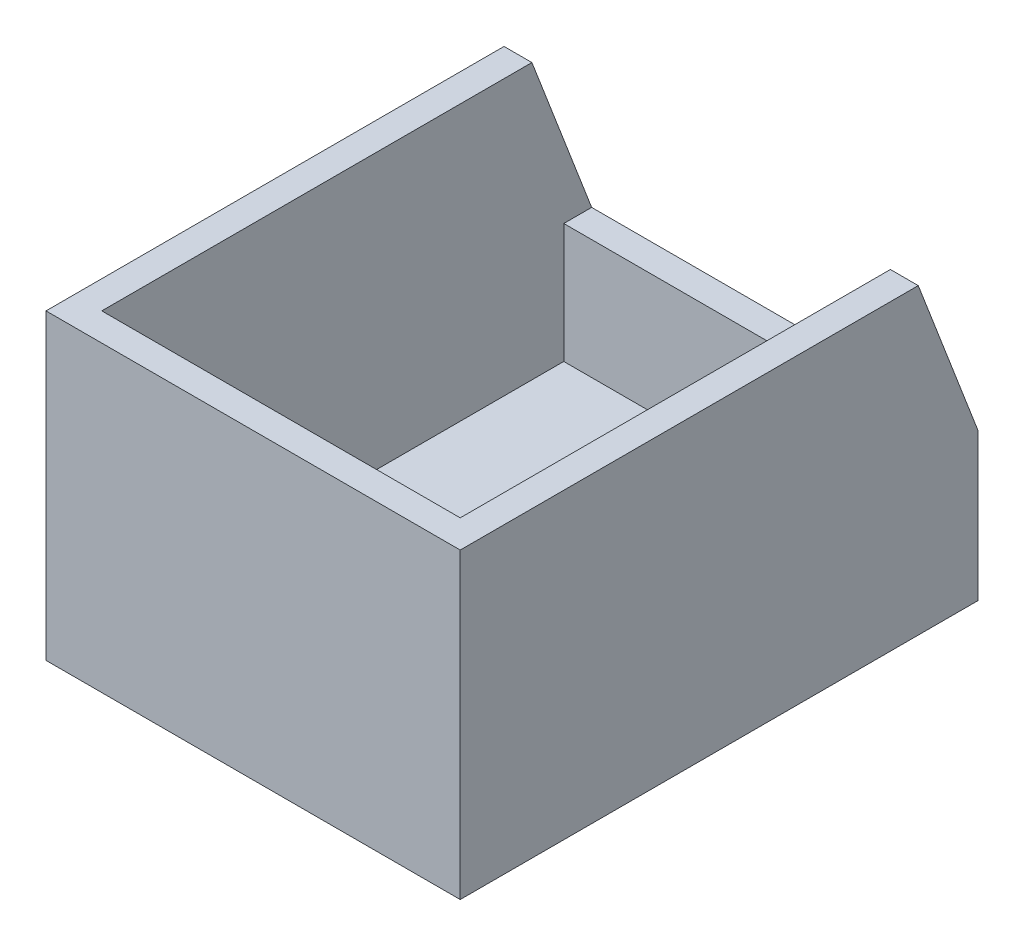
from build123d import *

# Parameters (mm, degrees)
BOSS_EXTRUDE1_DEPTH = 104
SHELL1_T            = -7
SKETCH3_W           = 90
SKETCH3_H           = 18.2
CUT_EXTRUDE1_DEPTH  = 104


with BuildPart() as part:
    # Sketch1 → Boss-Extrude1 (new body)
    with BuildSketch(Plane(origin=(0, 0, 0), x_dir=(0, 0, -1), z_dir=(1, 0, 0))):
        Polygon((0, 0), (130, 0), (130, 37), (115, 76), (0, 76), align=None)
    extrude(amount=BOSS_EXTRUDE1_DEPTH)

    # Shell1
    shell1_openings = [part.faces().sort_by_distance(p)[0] for p in [
        (52, 76, -57.5),
        (52, 56.5, -122.5),
    ]]
    offset(amount=SHELL1_T, openings=shell1_openings, kind=Kind.INTERSECTION)

    # Sketch3 → Cut-Extrude1 (cut)
    with BuildSketch(Plane.XY.offset(-123)):
        with Locations((52, 46.1)):
            Rectangle(SKETCH3_W, SKETCH3_H)
    extrude(amount=-CUT_EXTRUDE1_DEPTH, mode=Mode.SUBTRACT)


solid = part.part
